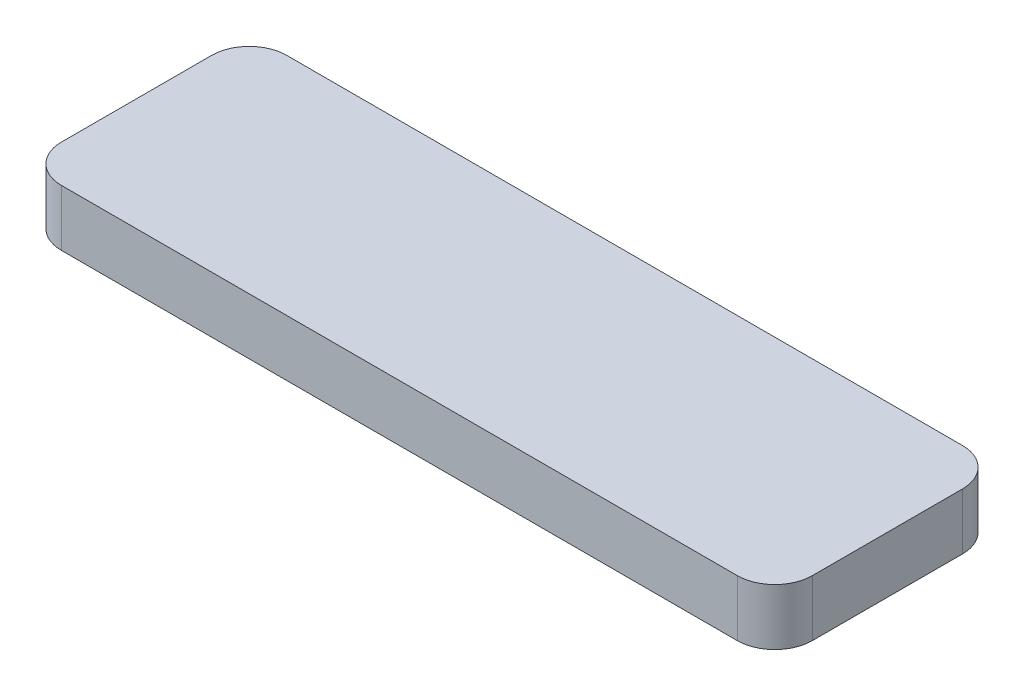
from build123d import *

# Parameters (mm, degrees)
RESSALTO_EXTRUS_O1_DEPTH = 3


with BuildPart() as part:
    # Esboço1 → Ressalto-extrusão1 (new body)
    with BuildSketch(Plane(origin=(0, 0, 0), x_dir=(1, 0, 0), z_dir=(0, 1, 0))):
        with BuildLine():
            Line((-21.623307055, 3.308576429), (14.376692945, 3.308576429))
            ThreePointArc((14.376692945, 3.308576429), (15.790906508, 2.722789992), (16.376692945, 1.308576429))
            Line((16.376692945, 1.308576429), (16.376692945, -6.691423571))
            ThreePointArc((16.376692945, -6.691423571), (15.790906508, -8.105637133), (14.376692945, -8.691423571))
            Line((14.376692945, -8.691423571), (-21.623307055, -8.691423571))
            ThreePointArc((-21.623307055, -8.691423571), (-23.037520617, -8.105637133), (-23.623307055, -6.691423571))
            Line((-23.623307055, -6.691423571), (-23.623307055, 1.308576429))
            ThreePointArc((-23.623307055, 1.308576429), (-23.037520617, 2.722789992), (-21.623307055, 3.308576429))
        make_face()
    extrude(amount=RESSALTO_EXTRUS_O1_DEPTH)


solid = part.part
